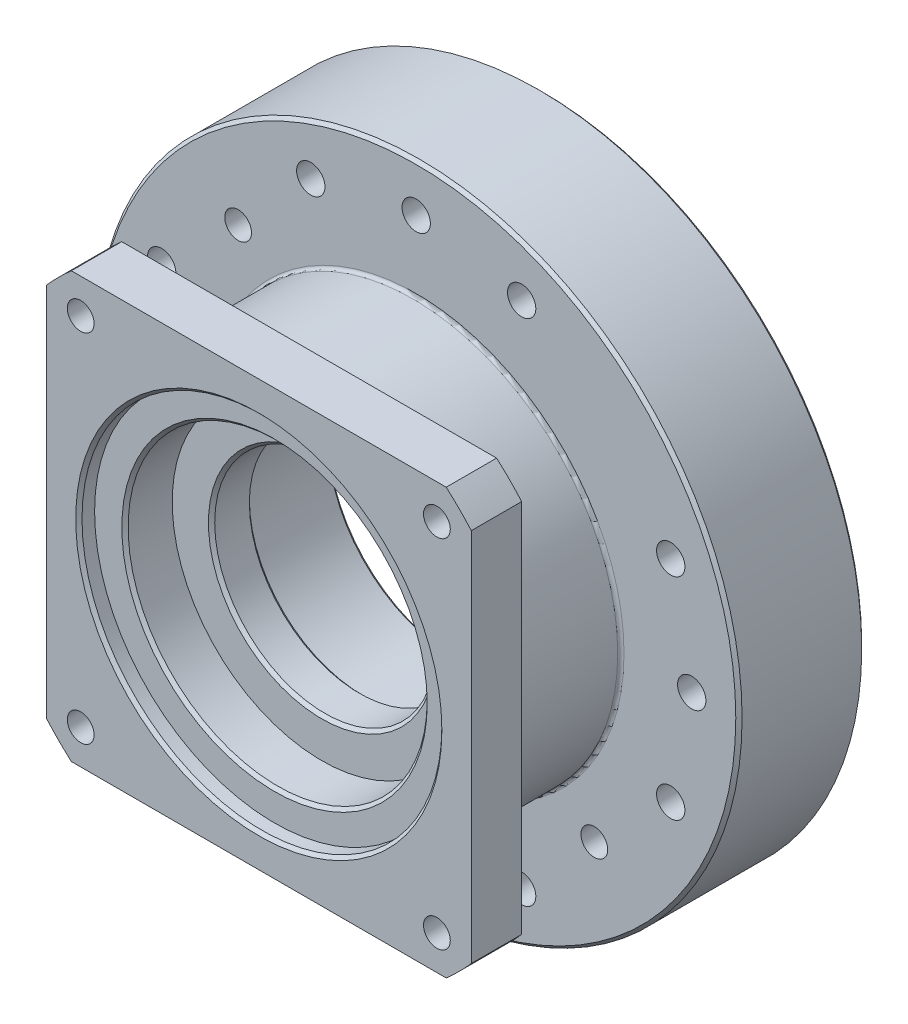
from build123d import *

# Parameters (mm, degrees)
SKETCH_1_R               = 102.5
EXTRUDE_1_DEPTH          = 40
SKETCH_3_R               = 95.25
CUT_EXTRUDE_1_DEPTH      = 4
SKETCH_5_R               = 80
CUT_EXTRUDE_3_DEPTH      = 15
SKETCH_6_W               = 130
SKETCH_6_H               = 130
EXTRUDE_2_DEPTH          = 34
SKETCH_7_R               = 47.5
CUT_EXTRUDE_4_DEPTH      = 4
CHAMFER_1_SIZE           = 10
SKETCH_8_R               = 35
CUT_EXTRUDE_5_DEPTH      = 161.97360032
SKETCH_9_R               = 79.5
CUT_EXTRUDE_7_DEPTH      = 8
SKETCH_14_R              = 4.5
CUT_EXTRUDE_8_DEPTH      = 163.752880159
PATTERN_CIRCULAR_1_COUNT = 16
SKETCH_17_W              = 4.25
SKETCH_17_H              = 40
CHAMFER_3_SIZE           = 0.5
CHAMFER_4_SIZE           = 0.5
SKETCH_21_OUTSIDE_W      = 266.842
SKETCH_21_OUTSIDE_H      = 266.842
SKETCH_21_OUTSIDE_R      = 65
CUT_EXTRUDE_11_DEPTH     = 34
FILLET_1_R               = 1
SKETCH_22_R              = 40
CUT_EXTRUDE_12_DEPTH     = 30
PATTERN_CIRCULAR_3_COUNT = 2
SKETCH_26_OUTSIDE_W      = 267.712
SKETCH_26_OUTSIDE_H      = 267.712
SKETCH_26_OUTSIDE_W_2    = 135
SKETCH_26_OUTSIDE_H_2    = 135
CUT_EXTRUDE_13_DEPTH     = 16
HOLE_WIZARD_M10_2_REACH  = 172.624
HOLE_WIZARD_M10_2_BORE_R = 4.25
PATTERN_CIRCULAR_4_COUNT = 4
CHAMFER_6_SIZE           = 1
CHAMFER_7_SIZE           = 1
CUT_EXTRUDE_14_REACH     = 170.548
SKETCH_29_R              = 5.5
SKETCH_29_R_2            = 6


with BuildPart() as part:
    # 草图1 → 凸台-拉伸1 (new body)
    with BuildSketch(Plane.XY):
        Circle(SKETCH_1_R)
    extrude(amount=EXTRUDE_1_DEPTH)

    # 草图3 → 切除-拉伸1 (cut)
    with BuildSketch(Plane(origin=(0, 0, 0), x_dir=(-1, 0, 0), z_dir=(0, 0, -1))):
        Circle(SKETCH_3_R)
    extrude(amount=-CUT_EXTRUDE_1_DEPTH, mode=Mode.SUBTRACT)

    # 草图5 → 切除-拉伸3 (cut)
    with BuildSketch(Plane(origin=(0, 0, 4), x_dir=(-1, 0, 0), z_dir=(0, 0, -1))):
        Circle(SKETCH_5_R)
    extrude(amount=-CUT_EXTRUDE_3_DEPTH, mode=Mode.SUBTRACT)

    # 草图6 → 凸台-拉伸2 (add)
    with BuildSketch(Plane.XY.offset(40)):
        Rectangle(SKETCH_6_W, SKETCH_6_H)
    extrude(amount=EXTRUDE_2_DEPTH)

    # 草图7 → 切除-拉伸4 (cut)
    with BuildSketch(Plane.XY.offset(74)):
        Circle(SKETCH_7_R)
    extrude(amount=-CUT_EXTRUDE_4_DEPTH, mode=Mode.SUBTRACT)

    # 倒角1
    chamfer_1_edges = [part.edges().sort_by_distance(p)[0] for p in [
        (-65, 65, 57),
        (-65, -65, 57),
        (65, -65, 57),
        (65, 65, 57),
    ]]
    chamfer(chamfer_1_edges, length=CHAMFER_1_SIZE)

    # 草图8 → 切除-拉伸5 (cut, through all)
    with BuildSketch(Plane.XY.offset(70)):
        Circle(SKETCH_8_R)
    extrude(amount=-CUT_EXTRUDE_5_DEPTH, mode=Mode.SUBTRACT)

    # 草图9 → 切除-拉伸7 (cut)
    with BuildSketch(Plane(origin=(0, 0, 19), x_dir=(-1, 0, 0), z_dir=(0, 0, -1))):
        Circle(SKETCH_9_R)
    extrude(amount=-CUT_EXTRUDE_7_DEPTH, mode=Mode.SUBTRACT)

    # 草图14 → 切除-拉伸8 (cut, through all)
    with BuildSketch(Plane(origin=(0, 0, 0), x_dir=(-1, 0, 0), z_dir=(0, 0, -1))):
        with Locations((87.5, 0)):
            Circle(SKETCH_14_R)
    cut_extrude_8 = extrude(amount=-CUT_EXTRUDE_8_DEPTH, mode=Mode.SUBTRACT)

    # 阵列(圆周)1: 切除-拉伸8 ×16 about axis, 4 skipped
    pattern_circular_1_axis = Axis((0, 0, 0), (0, 0, 1))
    add([cut_extrude_8.rotate(pattern_circular_1_axis, i * 360 / PATTERN_CIRCULAR_1_COUNT) for i in range(1, PATTERN_CIRCULAR_1_COUNT) if i not in (2, 6, 10, 14)], mode=Mode.SUBTRACT)

    # 草图17 → M10 螺纹孔1 (revolve, cut)
    with BuildSketch(Plane(origin=(56.568542495, -56.568542495, 40), x_dir=(0, -1, 0), z_dir=(1, 0, 0))):
        with Locations((2.125, 20)):
            Rectangle(SKETCH_17_W, SKETCH_17_H)
    hole_wizard_m10_1 = revolve(axis=Axis((56.568542495, -56.568542495, 46.35), (0, 0, -1)), mode=Mode.SUBTRACT)

    # 倒角3
    chamfer_3_edges = [part.edges().sort_by_distance(p)[0] for p in [
        (95.25, 0, 0),
    ]]
    chamfer(chamfer_3_edges, length=CHAMFER_3_SIZE)

    # 倒角4
    chamfer_4_edges = [part.edges().sort_by_distance(p)[0] for p in [
        (28.640628334, 74.697485959, 4),
    ]]
    chamfer(chamfer_4_edges, length=CHAMFER_4_SIZE)

    # 草图21 outside → 切除-拉伸11 (cut)
    with BuildSketch(Plane.XY.offset(74)):
        Rectangle(SKETCH_21_OUTSIDE_W, SKETCH_21_OUTSIDE_H)
        Circle(SKETCH_21_OUTSIDE_R, mode=Mode.SUBTRACT)
    extrude(amount=-CUT_EXTRUDE_11_DEPTH, mode=Mode.SUBTRACT)

    # 圆角1
    fillet_1_edges = [part.edges().sort_by_distance(p)[0] for p in [
        (-65, 0, 40),
    ]]
    fillet(fillet_1_edges, radius=FILLET_1_R)

    # 草图22 → 切除-拉伸12 (cut)
    with BuildSketch(Plane(origin=(0, 0, 27), x_dir=(-1, 0, 0), z_dir=(0, 0, -1))):
        Circle(SKETCH_22_R)
    extrude(amount=-CUT_EXTRUDE_12_DEPTH, mode=Mode.SUBTRACT)

    # 阵列(圆周)3: M10 螺纹孔1 ×2 about axis
    pattern_circular_3_axis = Axis((0, 0, 0), (0, 0, 1))
    for i in range(1, PATTERN_CIRCULAR_3_COUNT):
        add(hole_wizard_m10_1.rotate(pattern_circular_3_axis, i * 360 / PATTERN_CIRCULAR_3_COUNT), mode=Mode.SUBTRACT)

    # 草图24 → 旋转2 (revolve)
    with BuildSketch(Plane(origin=(0, 0, 0), x_dir=(1, 0, 0), z_dir=(0, 1, 0)), mode=Mode.PRIVATE) as revolve_2_sk:
        Polygon((-90, -74), (-47.5, -74), (-47.5, -85), (-57.15, -85), (-57.15, -90), (-90, -90), align=None)
    revolve(revolve_2_sk.sketch.rotate(Axis((0, 0, 0), (0, 0, 1)), 180), axis=Axis((0, 0, 0), (0, 0, 1)))

    # 草图26 outside → 切除-拉伸13 (cut)
    with BuildSketch(Plane.XY.offset(90)):
        Rectangle(SKETCH_26_OUTSIDE_W, SKETCH_26_OUTSIDE_H)
        Rectangle(SKETCH_26_OUTSIDE_W_2, SKETCH_26_OUTSIDE_H_2, mode=Mode.SUBTRACT)
    extrude(amount=-CUT_EXTRUDE_13_DEPTH, mode=Mode.SUBTRACT)

    # M10 螺纹孔2 bore → M10 螺纹孔2 (cut, up to next)
    with BuildSketch(Plane.XY.offset(90), mode=Mode.PRIVATE) as hole_wizard_m10_2_sk1:
        with Locations((56.568542495, 56.568542495)):
            Circle(HOLE_WIZARD_M10_2_BORE_R)
    hole_wizard_m10_2_tool1 = extrude(hole_wizard_m10_2_sk1.sketch, amount=-HOLE_WIZARD_M10_2_REACH, mode=Mode.PRIVATE) & part.part
    hole_wizard_m10_2 = hole_wizard_m10_2_tool1.solids().sort_by_distance((56.568542, 56.568542, 90))[0]
    add(hole_wizard_m10_2, mode=Mode.SUBTRACT)

    # 阵列(圆周)4: M10 螺纹孔2 ×4 about axis
    pattern_circular_4_axis = Axis((0, 0, 0), (0, 0, 1))
    for i in range(1, PATTERN_CIRCULAR_4_COUNT):
        add(hole_wizard_m10_2.rotate(pattern_circular_4_axis, i * 360 / PATTERN_CIRCULAR_4_COUNT), mode=Mode.SUBTRACT)

    # 倒角6
    chamfer_6_edges = [part.edges().sort_by_distance(p)[0] for p in [
        (40, 0, 27),
        (-35, 0, 57),
        (-57.15, 0, 90),
        (-47.5, 0, 85),
        (-35, 0, 70),
    ]]
    chamfer(chamfer_6_edges, length=CHAMFER_6_SIZE)

    # 倒角7
    chamfer_7_edges = [part.edges().sort_by_distance(p)[0] for p in [
        (-102.5, 0, 0),
        (-102.5, 0, 40),
    ]]
    chamfer(chamfer_7_edges, length=CHAMFER_7_SIZE)

    # 切除-拉伸14: up to this face of the body (flat: up to its plane)
    cut_extrude_14_end = Plane(part.part.faces().sort_by_distance((43.248599564, 0, 27))[0])
    # 草图29 → 切除-拉伸14 (cut, up to the picked face)
    with BuildSketch(Plane(origin=(0, 0, 4), x_dir=(-1, 0, 0), z_dir=(0, 0, -1)), mode=Mode.PRIVATE) as cut_extrude_14_sk1:
        with Locations((-56.568542495, -56.568542495)):
            Circle(SKETCH_29_R)
    cut_extrude_14_tool1 = split(extrude(cut_extrude_14_sk1.sketch, amount=-CUT_EXTRUDE_14_REACH, mode=Mode.PRIVATE), bisect_by=cut_extrude_14_end, keep=Keep.BOTH, mode=Mode.PRIVATE)
    # 草图29 → 切除-拉伸14 (cut, up to the picked face)
    with BuildSketch(Plane(origin=(0, 0, 4), x_dir=(-1, 0, 0), z_dir=(0, 0, -1)), mode=Mode.PRIVATE) as cut_extrude_14_sk2:
        with Locations((56.568542495, 56.568542495)):
            Circle(SKETCH_29_R_2)
    cut_extrude_14_tool2 = split(extrude(cut_extrude_14_sk2.sketch, amount=-CUT_EXTRUDE_14_REACH, mode=Mode.PRIVATE), bisect_by=cut_extrude_14_end, keep=Keep.BOTH, mode=Mode.PRIVATE)
    add(cut_extrude_14_tool1.solids().sort_by(Axis((56.568542, -56.568542, 4), (0, 0, 1)))[0], mode=Mode.SUBTRACT)
    add(cut_extrude_14_tool2.solids().sort_by(Axis((-56.568542, 56.568542, 4), (0, 0, 1)))[0], mode=Mode.SUBTRACT)


solid = part.part
